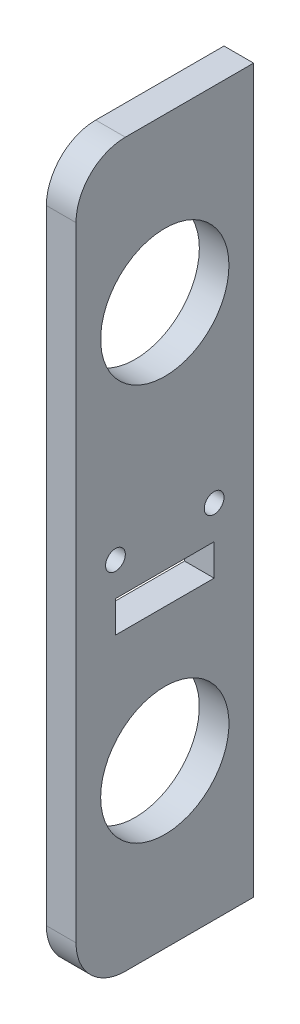
from build123d import *

# Parameters (mm, degrees)
CROQUIS1_W              = 18
CROQUIS1_H              = 73.2
CROQUIS1_R              = 6.5
CROQUIS1_R_2            = 1
CROQUIS1_W_2            = 10
CROQUIS1_H_2            = 3.2
SALIENTE_EXTRUIR1_DEPTH = 3
REDONDEO1_R             = 5


with BuildPart() as part:
    # Croquis1 → Saliente-Extruir1 (new body)
    with BuildSketch(Plane(origin=(0, 0, 0), x_dir=(0, 0, -1), z_dir=(1, 0, 0))):
        Rectangle(CROQUIS1_W, CROQUIS1_H)
        with Locations((0, 20.1)):
            Circle(CROQUIS1_R, mode=Mode.SUBTRACT)
        with Locations(Location((0, -20.1, 0), (0, 0, 180))):
            Circle(CROQUIS1_R, mode=Mode.SUBTRACT)
        with Locations((-5, 0)):
            Circle(CROQUIS1_R_2, mode=Mode.SUBTRACT)
        with Locations(Location((5, 0, 0), (0, 0, 180))):
            Circle(CROQUIS1_R_2, mode=Mode.SUBTRACT)
        with Locations((0, -5)):
            Rectangle(CROQUIS1_W_2, CROQUIS1_H_2, mode=Mode.SUBTRACT)
    extrude(amount=SALIENTE_EXTRUIR1_DEPTH)

    # Redondeo1
    redondeo1_edges = [part.edges().sort_by_distance(p)[0] for p in [
        (1.5, 36.6, 9),
        (1.5, -36.6, 9),
    ]]
    fillet(redondeo1_edges, radius=REDONDEO1_R)


solid = part.part
